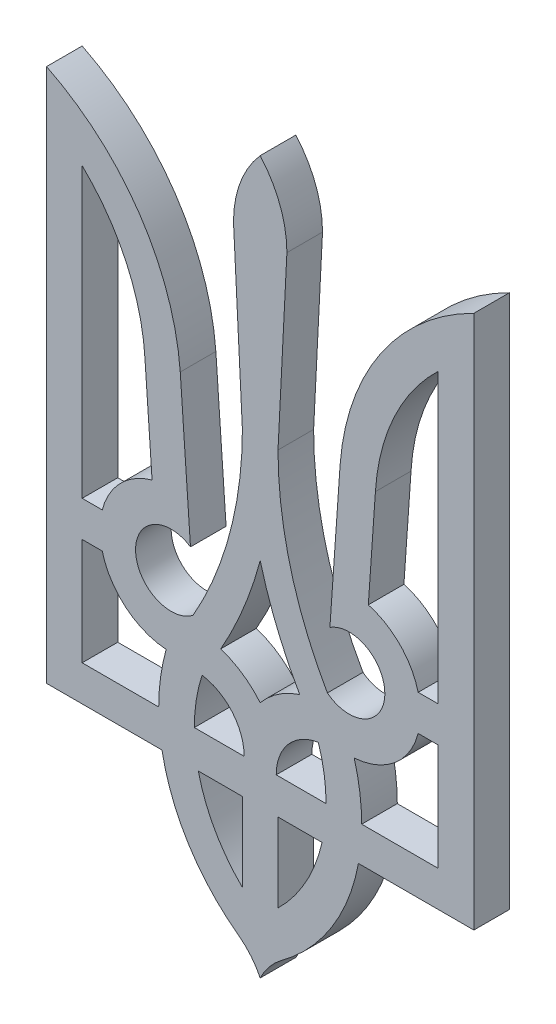
from build123d import *

# Parameters (mm, degrees)
EXTRUDE_1_DEPTH = 10
SCALE_1_SCALE   = 0.5


with BuildPart() as part:
    # Эскиз1 → Бобышка-Вытянуть1 (new body)
    with BuildSketch(Plane.XY):
        with BuildLine():
            Line((-60, -45), (-27.583269132, -45))
            ThreePointArc((-27.583269132, -45), (-20.06001769, -64.277376125), (-5.945767968, -79.41027067))
            ThreePointArc((-5.945767968, -79.41027067), (-2.542345747, -82.680315027), (0, -86.656865167))
            Line((0, -86.656865167), (0, -19.711115149))
            ThreePointArc((0, -19.711115149), (-5.008387109, -15.151161707), (-11.091351129, -12.172124017))
            ThreePointArc((-11.091351129, -12.172124017), (-4.677676581, 0.965070873), (0, 14.815718966))
            Line((0, 14.815718966), (0, 113.343134833))
            ThreePointArc((0, 113.343134833), (-5.562430401, 104.106601718), (-7.5, 93.5))
            Line((-7.5, 93.5), (-5, 44.25))
            ThreePointArc((-5, 44.25), (-8.525159088, 17.271181236), (-18.863936417, -7.896120801))
            ThreePointArc((-18.863936417, -7.896120801), (-34.990467135, -0.436539144), (-19.576058944, 8.401241779))
            Line((-19.576058944, 8.401241779), (-22.449472465, 49.49296956))
            ThreePointArc((-22.449472465, 49.49296956), (-33.881518529, 82.214174393), (-60, 105))
            Line((-60, 105), (-60, -45))
        make_face()
        with BuildLine():
            ThreePointArc((-26.401072965, -19.950864506), (-27.972740949, -27.40259956), (-28.5, -35))
            Line((-28.5, -35), (-50, -35))
            Line((-50, -35), (-50, -5))
            Line((-50, -5), (-44.364916731, -5))
            ThreePointArc((-44.364916731, -5), (-37.794087282, -15.372421104), (-26.401072965, -19.950864506))
        make_face(mode=Mode.SUBTRACT)
        with BuildLine():
            Line((-5, -45), (-5, -67.136427928))
            ThreePointArc((-5, -67.136427928), (-12.779082294, -56.957998409), (-17.374821937, -45))
            Line((-17.374821937, -45), (-5, -45))
        make_face(mode=Mode.SUBTRACT)
        with BuildLine():
            Line((-4.5, -35), (-18.5, -35))
            ThreePointArc((-18.5, -35), (-17.952221542, -28), (-16.322222222, -21.170419965))
            ThreePointArc((-16.322222222, -21.170419965), (-7.858362699, -25.902991945), (-4.5, -35))
        make_face(mode=Mode.SUBTRACT)
        with BuildLine():
            Line((-44.364916731, 5), (-50, 5))
            Line((-50, 5), (-50, 85.909197079))
            ThreePointArc((-50, 85.909197079), (-37.591425702, 68.515820434), (-32.355603325, 47.801370616))
            Line((-32.355603325, 47.801370616), (-30.360374841, 19.268273964))
            ThreePointArc((-30.360374841, 19.268273964), (-39.273434111, 14.009606657), (-44.364916731, 5))
        make_face(mode=Mode.SUBTRACT)
    extrude_1 = extrude(amount=EXTRUDE_1_DEPTH)

    # Зеркальное отражение1: Бобышка-Вытянуть1 across plane
    add(extrude_1.mirror(Plane(origin=(0, 0, 0), x_dir=(0, 0, 1), z_dir=(1, 0, 0))))


with BuildPart() as part_1:
    # Масштаб1: scaled about (0, 12.329369983, 5)
    add(part.part.scale(SCALE_1_SCALE).moved(Location((0, 6.164684991, 2.5))))


solid = part_1.part
